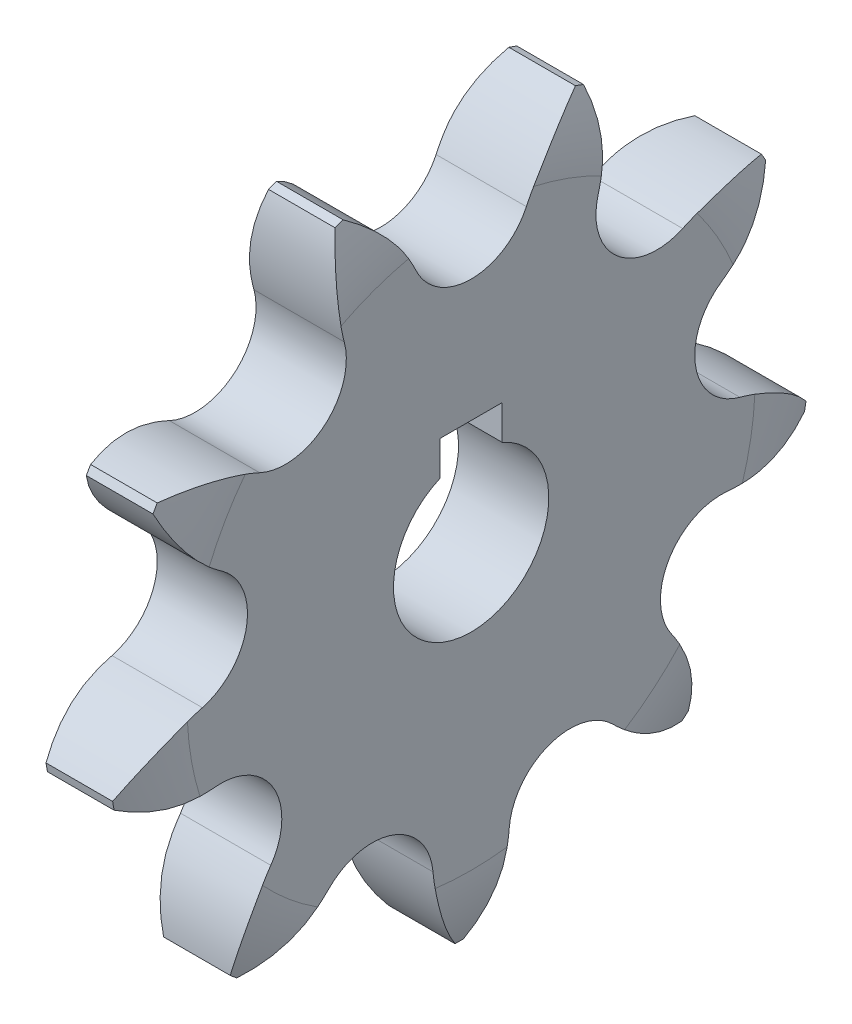
from build123d import *

# Parameters (mm, degrees)
TOOTHCUT_DEPTH  = 33.511421565
TEETHCUTS_COUNT = 9
TEETHCUTS_ANGLE = 320
BORSKE_R        = 5
BORE_DEPTH      = 50.0005
KEYSKE_W        = 4
KEYSKE_H        = 6.8
KEYWAY_DEPTH    = 50.0005


with BuildPart() as part:
    # BasProSke → Base-Revolve (revolve)
    with BuildSketch(Plane(origin=(0, 0, 0), x_dir=(1, 0, 0), z_dir=(0, 1, 0)), mode=Mode.PRIVATE) as base_revolve_sk:
        with BuildLine():
            Line((0, 0), (0, 18.285742546))
            ThreePointArc((0, 18.285742546), (0.191950592, 20.485447071), (0.762, 22.618657961))
            Line((0.762, 22.618657961), (5.0505, 22.618657961))
            ThreePointArc((5.0505, 22.618657961), (5.620549408, 20.485447071), (5.8125, 18.285742546))
            Line((5.8125, 18.285742546), (5.8125, 0))
            Line((5.8125, 0), (0, 0))
        make_face()
    revolve(base_revolve_sk.sketch.rotate(Axis((-10, 0, 0), (1, 0, 0)), 180), axis=Axis((-10, 0, 0), (1, 0, 0)))

    # TooCutSke → ToothCut (cut, through all)
    with BuildSketch(Plane(origin=(0, 0, 0), x_dir=(0, 0, -1), z_dir=(1, 0, 0))):
        with BuildLine():
            ThreePointArc((3.55621581, 16.946717295), (5.415747479, 19.676223939), (8.046347206, 21.673224093))
            ThreePointArc((8.046347206, 21.673224093), (0, 23.118657961), (-8.046347206, 21.673224093))
            ThreePointArc((-8.046347206, 21.673224093), (-5.415747479, 19.676223939), (-3.55621581, 16.946717295))
            ThreePointArc((-3.55621581, 16.946717295), (0, 14.681157961), (3.55621581, 16.946717295))
        make_face()
    toothcut = extrude(amount=TOOTHCUT_DEPTH, mode=Mode.SUBTRACT)

    # TeethCuts: ToothCut ×9 about axis
    teethcuts_axis = Axis((-10, 0, 0), (1, 0, 0))
    for i in range(1, TEETHCUTS_COUNT):
        add(toothcut.rotate(teethcuts_axis, i * TEETHCUTS_ANGLE / (TEETHCUTS_COUNT - 1)), mode=Mode.SUBTRACT)

    # BorSke → Bore (cut, symmetric)
    with BuildSketch(Plane(origin=(0, 0, 0), x_dir=(0, 0, -1), z_dir=(1, 0, 0))):
        with Locations(Location((0, 0, 0), (0, 0, 180))):
            Circle(BORSKE_R)
    extrude(amount=BORE_DEPTH, both=True, mode=Mode.SUBTRACT)

    # KeySke → Keyway (cut, symmetric)
    with BuildSketch(Plane(origin=(0, 0, 0), x_dir=(0, 0, -1), z_dir=(1, 0, 0))):
        with Locations((0, 3.4)):
            Rectangle(KEYSKE_W, KEYSKE_H)
    extrude(amount=KEYWAY_DEPTH, both=True, mode=Mode.SUBTRACT)


solid = part.part
